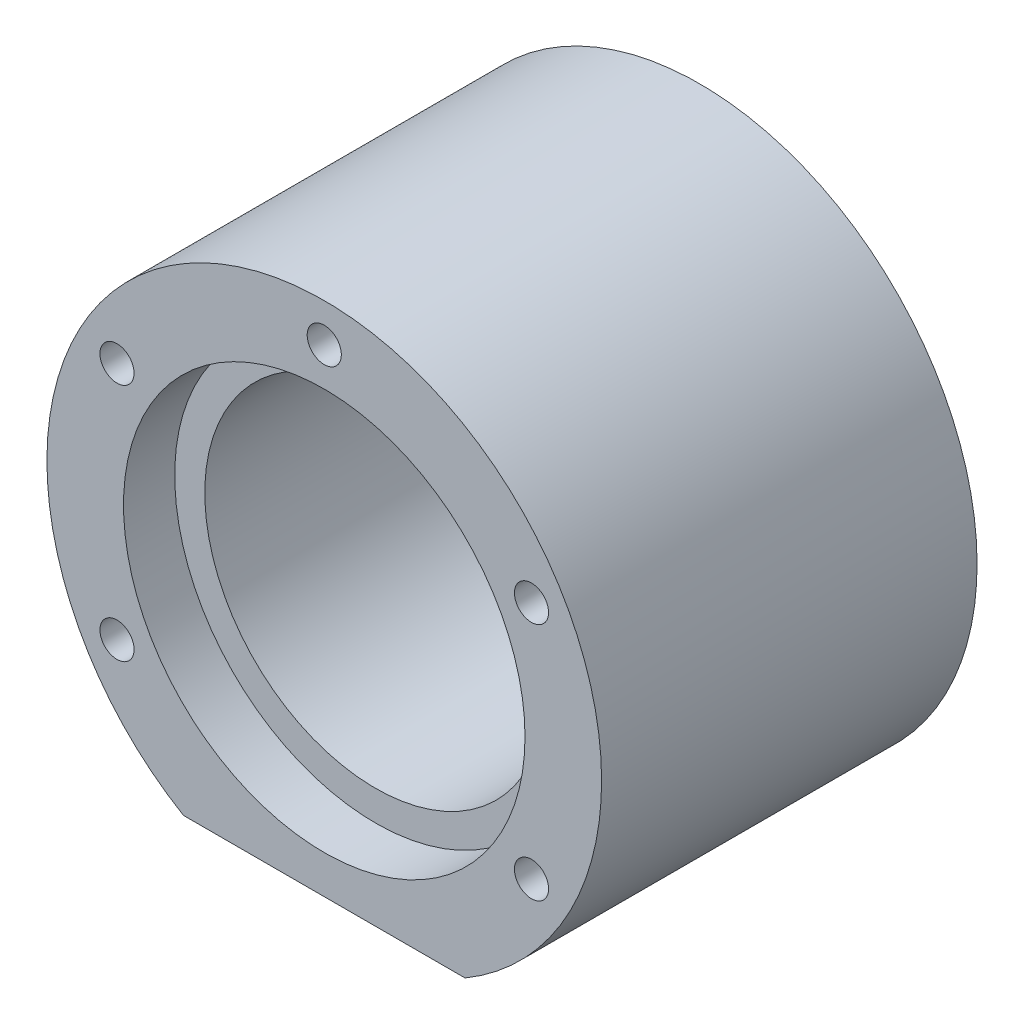
from build123d import *

# Parameters (mm, degrees)
SKETCH1_R                = 23.525
SKETCH1_R_2              = 2
BOSS_EXTRUDE1_DEPTH      = 44
BOSS_EXTRUDE2_DEPTH      = 16
BOSS_EXTRUDE2_DEPTH_BACK = 16
SKETCH2_R                = 23.6
SKETCH2_R_2              = 20


with BuildPart() as part:
    # Sketch1 → Boss-Extrude1 (new body)
    with BuildSketch(Plane.XY):
        with BuildLine():
            Line((-16.5, -28), (16.5, -28))
            ThreePointArc((16.5, -28), (0, 32.5), (-16.5, -28))
        make_face()
        Circle(SKETCH1_R, mode=Mode.SUBTRACT)
        with Locations((0, 28)):
            Circle(SKETCH1_R_2, mode=Mode.SUBTRACT)
        with Locations((24.286071043, 13.978430346)):
            Circle(SKETCH1_R_2, mode=Mode.SUBTRACT)
        with Locations((24.286071043, -14.064708963)):
            Circle(SKETCH1_R_2, mode=Mode.SUBTRACT)
        with Locations((-24.286071043, -14.064708963)):
            Circle(SKETCH1_R_2, mode=Mode.SUBTRACT)
        with Locations((-24.286071043, 13.978430346)):
            Circle(SKETCH1_R_2, mode=Mode.SUBTRACT)
    extrude(amount=BOSS_EXTRUDE1_DEPTH)

    # Sketch2 → Boss-Extrude2 (add, two sides: drawn at the far end of the back side and taken through both)
    with BuildSketch(Plane.XY.offset(22).offset(-BOSS_EXTRUDE2_DEPTH_BACK)):
        Circle(SKETCH2_R)
        Circle(SKETCH2_R_2, mode=Mode.SUBTRACT)
    extrude(amount=BOSS_EXTRUDE2_DEPTH + BOSS_EXTRUDE2_DEPTH_BACK)


solid = part.part
